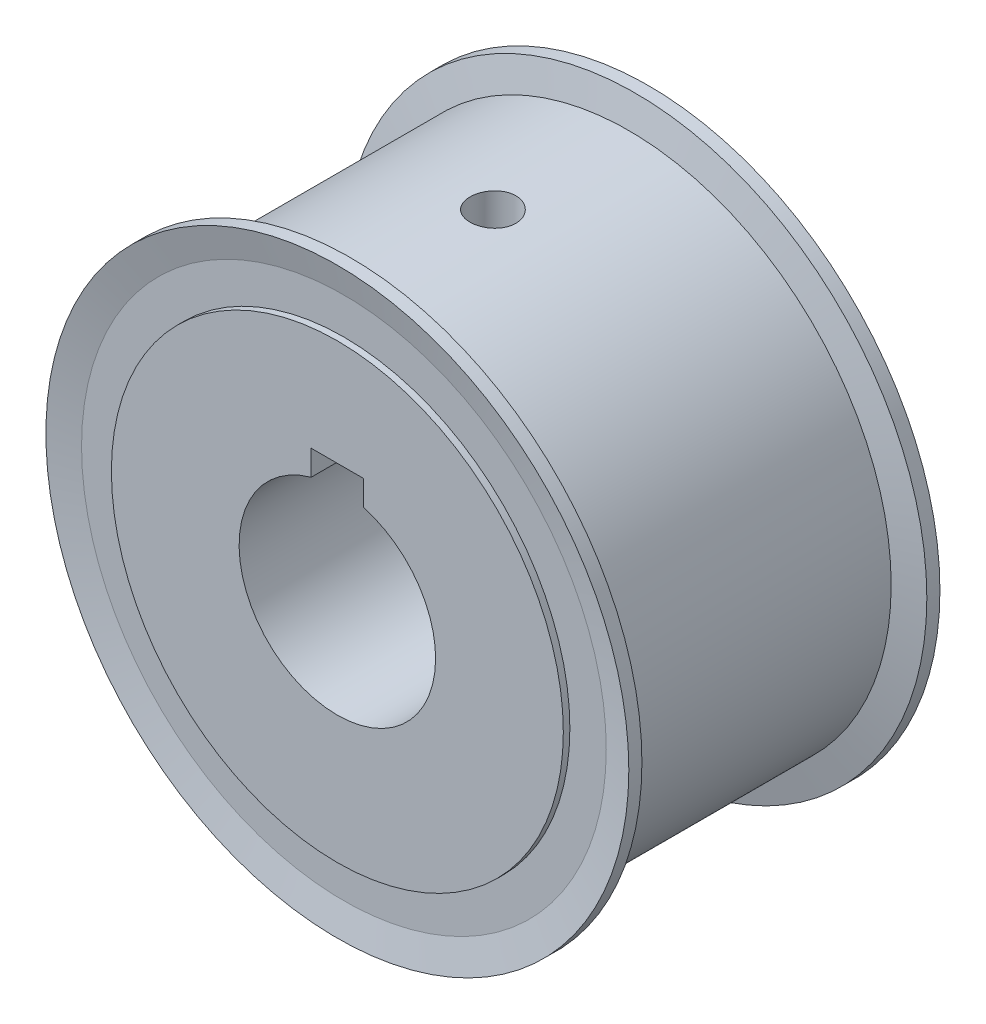
from build123d import *

# Parameters (mm, degrees)
SKETCH2_W                    = 47.5
SKETCH2_H                    = 15
CUT_EXTRUDE1_DEPTH           = 79.846369606
F_7_0_7_DIAMETER_HOLE1_D     = 7
F_7_0_7_DIAMETER_HOLE1_DEPTH = 10
M6X1_0_TAPPED_HOLE1_REACH    = 100.969
M6X1_0_TAPPED_HOLE1_BORE_R   = 2.5
CIRPATTERN1_COUNT            = 2
CIRPATTERN1_ANGLE            = 120


with BuildPart() as part:
    # Sketch1 → Revolve1 (revolve)
    with BuildSketch(Plane(origin=(0, 0, 0), x_dir=(0, 0, -1), z_dir=(1, 0, 0)), mode=Mode.PRIVATE) as revolve1_sk:
        Polygon((-47.5, 34.5), (-46.5, 34.5), (-46.5, 40.055), (-47.5, 44.5), (-45.5, 44.5), (-44.5, 40.055), (-3, 40.055), (-2, 44.5), (0, 44.5), (-1, 40.055), (-1, 34.5), (0, 34.5), (0, 0), (-47.5, 0), align=None)
    revolve(revolve1_sk.sketch.rotate(Axis((0, 0, 52.856940479), (0, 0, -1)), 90), axis=Axis((0, 0, 52.856940479), (0, 0, -1)))

    # Sketch2 → Cut-Revolve1 (revolve, cut)
    with BuildSketch(Plane(origin=(0, 0, 0), x_dir=(0, 0, -1), z_dir=(1, 0, 0)), mode=Mode.PRIVATE) as cut_revolve1_sk:
        with Locations((-23.75, 7.5)):
            Rectangle(SKETCH2_W, SKETCH2_H)
    revolve(cut_revolve1_sk.sketch.rotate(Axis((0, 0, -27.972108766), (0, 0, 1)), 90), axis=Axis((0, 0, -27.972108766), (0, 0, 1)), mode=Mode.SUBTRACT)

    # Sketch3 → Cut-Extrude1 (cut, through all)
    with BuildSketch(Plane.XY.offset(47.5)):
        with BuildLine():
            Line((-4, 18.3), (4, 18.3))
            Line((4, 18.3), (4, 14.456832295))
            ThreePointArc((4, 14.456832295), (0, 15), (-4, 14.456832295))
            Line((-4, 14.456832295), (-4, 18.3))
        make_face()
    extrude(amount=-CUT_EXTRUDE1_DEPTH, mode=Mode.SUBTRACT)

    # Ø7.0 (7) Diameter Hole1
    with Locations(Plane(origin=(0, 40.055, 0), x_dir=(-1, 0, 0), z_dir=(0, 1, 0))):
        with Locations((0, 23.75)):
            f_7_0_7_diameter_hole1 = Hole(F_7_0_7_DIAMETER_HOLE1_D / 2, depth=F_7_0_7_DIAMETER_HOLE1_DEPTH)

    # M6x1.0 Tapped Hole1 bore → M6x1.0 Tapped Hole1 (cut, up to next)
    with BuildSketch(Plane(origin=(0, 30.055, 0), x_dir=(-1, 0, 0), z_dir=(0, 1, 0)), mode=Mode.PRIVATE) as m6x1_0_tapped_hole1_sk1:
        with Locations((0, 23.75)):
            Circle(M6X1_0_TAPPED_HOLE1_BORE_R)
    m6x1_0_tapped_hole1_tool1 = extrude(m6x1_0_tapped_hole1_sk1.sketch, amount=-M6X1_0_TAPPED_HOLE1_REACH, mode=Mode.PRIVATE) & part.part
    m6x1_0_tapped_hole1 = m6x1_0_tapped_hole1_tool1.solids().sort_by_distance((0, 30.055, 23.75))[0]
    add(m6x1_0_tapped_hole1, mode=Mode.SUBTRACT)

    # CirPattern1: Ø7.0 (7) Diameter Hole1, M6x1.0 Tapped Hole1; each copy of M6x1.0 Tapped Hole1 runs up to whatever stops it at its own place
    cirpattern1_before = part.part  # the part as the pattern finds it: every copy runs up to it
    add(f_7_0_7_diameter_hole1.rotate(Axis((0, 0, -27.972108766), (0, 0, 1)), 1 * CIRPATTERN1_ANGLE / (CIRPATTERN1_COUNT - 1)), mode=Mode.SUBTRACT)
    cirpattern1_m6x1_0_tapped_hole1_long = extrude(m6x1_0_tapped_hole1_sk1.sketch, amount=-M6X1_0_TAPPED_HOLE1_REACH, mode=Mode.PRIVATE)
    cirpattern1_m6x1_0_tapped_hole1_tool1 = cirpattern1_m6x1_0_tapped_hole1_long.rotate(Axis((0, 0, -27.972108766), (0, 0, 1)), 1 * CIRPATTERN1_ANGLE / (CIRPATTERN1_COUNT - 1)) & cirpattern1_before
    add(cirpattern1_m6x1_0_tapped_hole1_tool1.solids().sort_by_distance((-26.028394, -15.0275, 23.75))[0], mode=Mode.SUBTRACT)


solid = part.part
